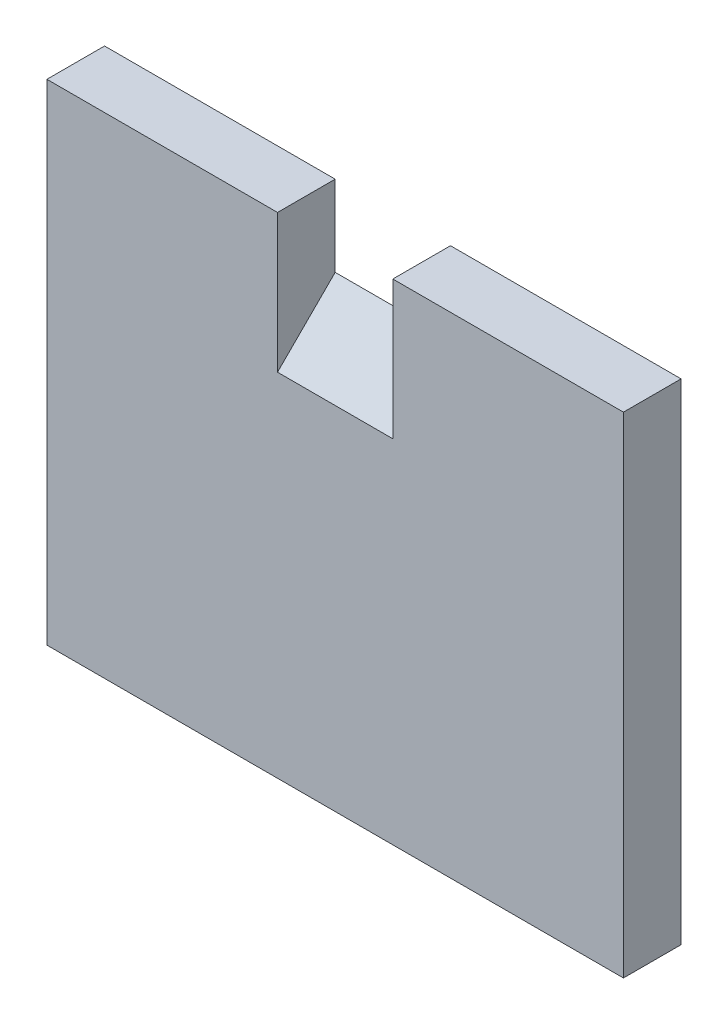
from build123d import *

# Parameters (mm, degrees)
BOSS_EXTRU_1_DEPTH      = 10
ENL_V_MAT_EXTRU_1_DEPTH = 60
BOSS_EXTRU_2_DEPTH      = 40
ESQUISSE5_W             = 10
ESQUISSE5_H             = 30
BOSS_EXTRU_3_DEPTH      = 60
ESQUISSE6_W             = 10
ESQUISSE6_H             = 14
ENL_V_MAT_EXTRU_2_DEPTH = 60
ESQUISSE9_W             = 10
ESQUISSE9_H             = 14
BOSS_EXTRU_4_DEPTH      = 40
ENL_V_MAT_EXTRU_3_DEPTH = 60
BOSS_EXTRU_5_DEPTH      = 40
ESQUISSE13_W            = 10
ESQUISSE13_H            = 31.398637822
BOSS_EXTRU_6_DEPTH      = 60
ENL_V_MAT_EXTRU_9_DEPTH = 60
BOSS_EXTRU_7_DEPTH      = 40


with BuildPart() as part:
    # Esquisse1 → Boss.-Extru.1 (new body)
    with BuildSketch(Plane.XY):
        Polygon((-50, -42.5), (50, -42.5), (50, 42.5), (10, 42.5), (10, 28.5), (0, 28.5), (-10, 28.5), (-10, 42.5), (-50, 42.5), align=None)
    extrude(amount=BOSS_EXTRU_1_DEPTH)

    # Esquisse2 → Enlèv. mat.-Extru.1 (cut)
    with BuildSketch(Plane(origin=(50, 0, 0), x_dir=(0, 0, -1), z_dir=(1, 0, 0))):
        Polygon((-10, 28.5), (0, 18.5), (0, 28.5), align=None)
    extrude(amount=-ENL_V_MAT_EXTRU_1_DEPTH, mode=Mode.SUBTRACT)


with BuildPart() as enl_v_mat_extru_1_piece_1:
    # of the separate pieces the step leaves, piece 1, a body of its own (enl_v_mat_extru_1_pieces)
    add(part.part.solids().sort_by_distance((-50, -42.5, 0))[0])



with BuildPart() as enl_v_mat_extru_1_piece_2:
    # of the separate pieces the step leaves, piece 2, a body of its own (enl_v_mat_extru_1_pieces)
    add(part.part.solids().sort_by_distance((10, 42.5, 10))[0])


with BuildPart() as enl_v_mat_extru_1_piece_1_1:
    add(enl_v_mat_extru_1_piece_1.part)

    add(enl_v_mat_extru_1_piece_2.part)  # Boss.-Extru.2 merges Enlèv. mat.-Extru.1 piece 2
    # Esquisse4 → Boss.-Extru.2 (add)
    with BuildSketch(Plane(origin=(50, 0, 0), x_dir=(0, 0, -1), z_dir=(1, 0, 0))):
        Polygon((-10, 28.5), (0, 18.5), (0, 28.5), align=None)
    extrude(amount=-BOSS_EXTRU_2_DEPTH)

    # Esquisse5 → Boss.-Extru.3 (add)
    with BuildSketch(Plane(origin=(50, 0, 0), x_dir=(0, 0, -1), z_dir=(1, 0, 0))):
        with Locations((-5, 27.5)):
            Rectangle(ESQUISSE5_W, ESQUISSE5_H)
    extrude(amount=-BOSS_EXTRU_3_DEPTH)

    # Esquisse6 → Enlèv. mat.-Extru.2 (cut)
    with BuildSketch(Plane(origin=(50, 0, 0), x_dir=(0, 0, -1), z_dir=(1, 0, 0))):
        with Locations((-5, 35.5)):
            Rectangle(ESQUISSE6_W, ESQUISSE6_H)
    extrude(amount=-ENL_V_MAT_EXTRU_2_DEPTH, mode=Mode.SUBTRACT)

    # Esquisse9 → Boss.-Extru.4 (add)
    with BuildSketch(Plane(origin=(50, 0, 0), x_dir=(0, 0, -1), z_dir=(1, 0, 0))):
        with Locations((-5, 35.5)):
            Rectangle(ESQUISSE9_W, ESQUISSE9_H)
    extrude(amount=-BOSS_EXTRU_4_DEPTH)

    # Esquisse11 → Enlèv. mat.-Extru.3 (cut)
    with BuildSketch(Plane(origin=(50, 0, 0), x_dir=(0, 0, -1), z_dir=(1, 0, 0))):
        Polygon((0, 18.5), (0, 28.5), (-10, 28.5), align=None)
    extrude(amount=-ENL_V_MAT_EXTRU_3_DEPTH, mode=Mode.SUBTRACT)


with BuildPart() as enl_v_mat_extru_3_piece_1:
    # of the separate pieces the step leaves, piece 1, a body of its own (enl_v_mat_extru_3_pieces)
    add(enl_v_mat_extru_1_piece_1_1.part.solids().sort_by_distance((-10, 28.5, 10))[0])



with BuildPart() as enl_v_mat_extru_3_piece_2:
    # of the separate pieces the step leaves, piece 2, a body of its own (enl_v_mat_extru_3_pieces)
    add(enl_v_mat_extru_1_piece_1_1.part.solids().sort_by_distance((10, 42.5, 10))[0])


with BuildPart() as enl_v_mat_extru_3_piece_1_1:
    add(enl_v_mat_extru_3_piece_1.part)

    add(enl_v_mat_extru_3_piece_2.part)  # Boss.-Extru.5 merges Enlèv. mat.-Extru.3 piece 2
    # Esquisse12 → Boss.-Extru.5 (add)
    with BuildSketch(Plane(origin=(50, 0, 0), x_dir=(0, 0, -1), z_dir=(1, 0, 0))):
        Polygon((-10, 28.5), (0, 28.5), (0, 18.5), align=None)
    extrude(amount=-BOSS_EXTRU_5_DEPTH)

    # Esquisse13 → Boss.-Extru.6 (add)
    with BuildSketch(Plane(origin=(50, 0, 0), x_dir=(0, 0, -1), z_dir=(1, 0, 0))):
        with Locations((-5, 12.800681089)):
            Rectangle(ESQUISSE13_W, ESQUISSE13_H)
    extrude(amount=-BOSS_EXTRU_6_DEPTH)

    # Esquisse16 → Enlèv. mat.-Extru.9 (cut)
    with BuildSketch(Plane(origin=(50, 0, 0), x_dir=(0, 0, -1), z_dir=(1, 0, 0))):
        Polygon((-10, 28.5), (0, 28.5), (-10, 18.5), align=None)
    extrude(amount=-ENL_V_MAT_EXTRU_9_DEPTH, mode=Mode.SUBTRACT)


with BuildPart() as enl_v_mat_extru_9_piece_1:
    # of the separate pieces the step leaves, piece 1, a body of its own (enl_v_mat_extru_9_pieces)
    add(enl_v_mat_extru_3_piece_1_1.part.solids().sort_by_distance((50, -42.5, 10))[0])



with BuildPart() as enl_v_mat_extru_9_piece_2:
    # of the separate pieces the step leaves, piece 2, a body of its own (enl_v_mat_extru_9_pieces)
    add(enl_v_mat_extru_3_piece_1_1.part.solids().sort_by_distance((50, 28.5, 10))[0])


with BuildPart() as enl_v_mat_extru_9_piece_1_1:
    add(enl_v_mat_extru_9_piece_1.part)

    add(enl_v_mat_extru_9_piece_2.part)  # Boss.-Extru.7 merges Enlèv. mat.-Extru.9 piece 2
    # Esquisse17 → Boss.-Extru.7 (add)
    with BuildSketch(Plane(origin=(50, 0, 0), x_dir=(0, 0, -1), z_dir=(1, 0, 0))):
        Polygon((-10, 28.5), (0, 28.5), (-10, 18.5), align=None)
    extrude(amount=-BOSS_EXTRU_7_DEPTH)


solid = enl_v_mat_extru_9_piece_1_1.part
